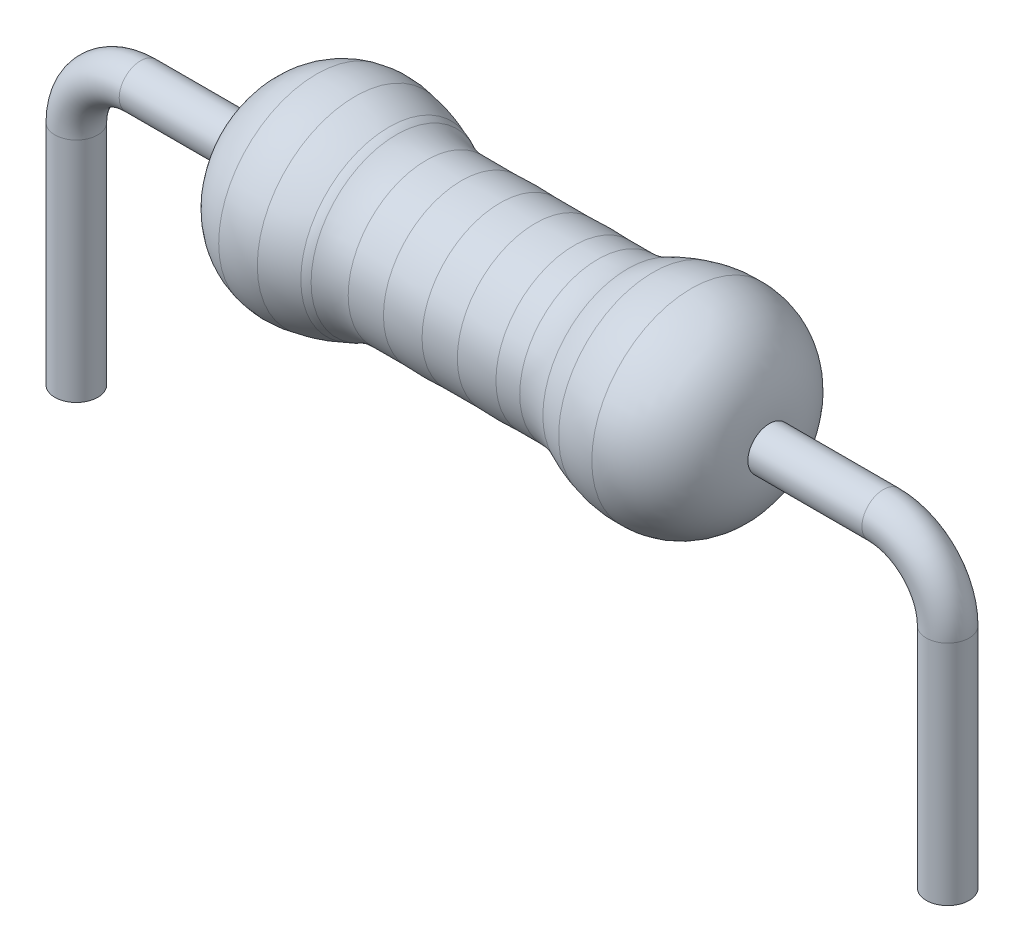
from build123d import *

# Parameters (mm, degrees)
SKETCH2_R = 0.25


with BuildPart() as part:
    # Sweep1: sweep along a path in Sketch1
    with BuildLine(Plane.XY) as sweep1_path:
        Line((-5.08, -3.4), (-5.08, -0.75))
        ThreePointArc((-5.08, -0.75), (-4.860330086, -0.219669914), (-4.33, 0))
        Line((-4.33, 0), (4.33, 0))
        ThreePointArc((4.33, 0), (4.860330086, -0.219669914), (5.08, -0.75))
        Line((5.08, -0.75), (5.08, -3.4))
    # Sketch2 → Sweep1 (sweep)
    with BuildSketch(Plane(origin=(-5.08, -3.4, 0), x_dir=(-1, 0, 0), z_dir=(0, -1, 0))):
        Circle(SKETCH2_R)
    sweep(path=sweep1_path.line)

    # Sketch3 → Revolve1 (revolve)
    with BuildSketch(Plane.XY, mode=Mode.PRIVATE) as revolve1_sk:
        with BuildLine():
            Line((-3, 0.25), (-3, 0))
            Line((-3, 0), (3, 0))
            Line((3, 0), (3, 0.25))
            ThreePointArc((3, 0.25), (2.733467171, 0.893467171), (2.09, 1.16))
            ThreePointArc((2.09, 1.16), (1.710392802, 1.117024996), (1.35, 0.990275229))
            ThreePointArc((1.35, 0.990275229), (1.179543945, 0.930326015), (1, 0.91))
            Line((1, 0.91), (-1, 0.91))
            ThreePointArc((-1, 0.91), (-1.179543945, 0.930326015), (-1.35, 0.990275229))
            ThreePointArc((-1.35, 0.990275229), (-1.710392802, 1.117024996), (-2.09, 1.16))
            ThreePointArc((-2.09, 1.16), (-2.733467171, 0.893467171), (-3, 0.25))
        make_face()
    revolve(revolve1_sk.sketch.rotate(Axis((-3, 0, 0), (1, 0, 0)), 90), axis=Axis((-3, 0, 0), (1, 0, 0)))

    # Sketch5 → Revolve2 (revolve)
    with BuildSketch(Plane.XY, mode=Mode.PRIVATE) as revolve2_sk:
        with BuildLine():
            ThreePointArc((2.09, 1.16), (1.864572551, 1.14822478), (1.643967886, 1.100373215))
            ThreePointArc((1.643967886, 1.100373215), (1.865, 1.145027293), (2.09, 1.16))
        make_face()
        with BuildLine():
            ThreePointArc((0.722381779, 0.91), (0.497381779, 0.915065065), (0.272381779, 0.91))
            Line((0.272381779, 0.91), (0.722381779, 0.91))
        make_face()
        with BuildLine():
            ThreePointArc((-0.138809111, 0.91), (-0.363809111, 0.915065065), (-0.588809111, 0.91))
            Line((-0.588809111, 0.91), (-0.138809111, 0.91))
        make_face()
        with BuildLine():
            ThreePointArc((-2.09, 1.16), (-1.959569758, 1.154983337), (-1.829910188, 1.139962988))
            ThreePointArc((-1.829910188, 1.139962988), (-2.054910188, 1.165604225), (-2.279910188, 1.139962988))
            ThreePointArc((-2.279910188, 1.139962988), (-2.185482147, 1.154976883), (-2.09, 1.16))
        make_face()
        with BuildLine():
            ThreePointArc((-1.35, 0.990275229), (-1.179543945, 0.930326015), (-1, 0.91))
            ThreePointArc((-1, 0.91), (-1.179019479, 0.931459747), (-1.34789488, 0.994622978))
            ThreePointArc((-1.34789488, 0.994622978), (-1.390151551, 1.013716419), (-1.434186266, 1.028246719))
            ThreePointArc((-1.434186266, 1.028246719), (-1.391834938, 1.009833416), (-1.35, 0.990275229))
        make_face()
    revolve(revolve2_sk.sketch.rotate(Axis((-3, 0, 0), (1, 0, 0)), 90), axis=Axis((-3, 0, 0), (1, 0, 0)))


solid = part.part
